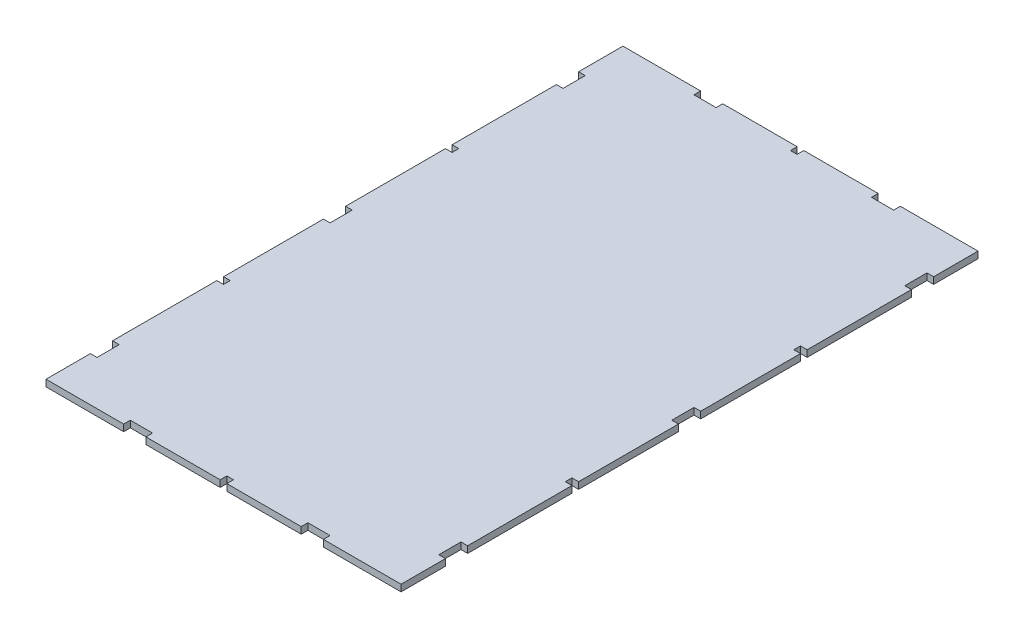
from build123d import *

# Parameters (mm, degrees)
SKETCH1_W           = 160
SKETCH1_H           = 260
BOSS_EXTRUDE1_DEPTH = 3
SKETCH7_W           = 3
SKETCH7_H           = 3
SKETCH7_W_2         = 10
SKETCH7_H_2         = 10
CUT_EXTRUDE2_DEPTH  = 171.026468528


with BuildPart() as part:
    # Sketch1 → Boss-Extrude1 (new body)
    with BuildSketch(Plane(origin=(0, 0, 0), x_dir=(1, 0, 0), z_dir=(0, 1, 0))):
        with Locations((0, -20)):
            Rectangle(SKETCH1_W, SKETCH1_H)
    extrude(amount=BOSS_EXTRUDE1_DEPTH)

    # Sketch7 → Cut-Extrude2 (cut, through all)
    with BuildSketch(Plane(origin=(0, 3, 0), x_dir=(1, 0, 0), z_dir=(0, 1, 0))):
        with Locations((0, 108.5)):
            Rectangle(SKETCH7_W, SKETCH7_H)
        with Locations((40, 108.5)):
            Rectangle(SKETCH7_W_2, SKETCH7_H)
        with Locations((-40, 108.5)):
            Rectangle(SKETCH7_W_2, SKETCH7_H)
        with Locations((40, -148.5)):
            Rectangle(SKETCH7_W_2, SKETCH7_H)
        with Locations((-40, -148.5)):
            Rectangle(SKETCH7_W_2, SKETCH7_H)
        with Locations((0, -148.5)):
            Rectangle(SKETCH7_W, SKETCH7_H)
        with Locations((-78.5, -125)):
            Rectangle(SKETCH7_W, SKETCH7_H_2)
        with Locations((-78.5, -20)):
            Rectangle(SKETCH7_W, SKETCH7_H_2)
        with Locations((-78.5, 85)):
            Rectangle(SKETCH7_W, SKETCH7_H_2)
        with Locations((-78.5, -71.5)):
            Rectangle(SKETCH7_W, SKETCH7_H)
        with Locations((-78.5, 31.5)):
            Rectangle(SKETCH7_W, SKETCH7_H)
        with Locations((78.5, -125)):
            Rectangle(SKETCH7_W, SKETCH7_H_2)
        with Locations((78.5, -71.5)):
            Rectangle(SKETCH7_W, SKETCH7_H)
        with Locations((78.5, -20)):
            Rectangle(SKETCH7_W, SKETCH7_H_2)
        with Locations((78.5, 31.5)):
            Rectangle(SKETCH7_W, SKETCH7_H)
        with Locations((78.5, 85)):
            Rectangle(SKETCH7_W, SKETCH7_H_2)
    extrude(amount=-CUT_EXTRUDE2_DEPTH, mode=Mode.SUBTRACT)


solid = part.part
